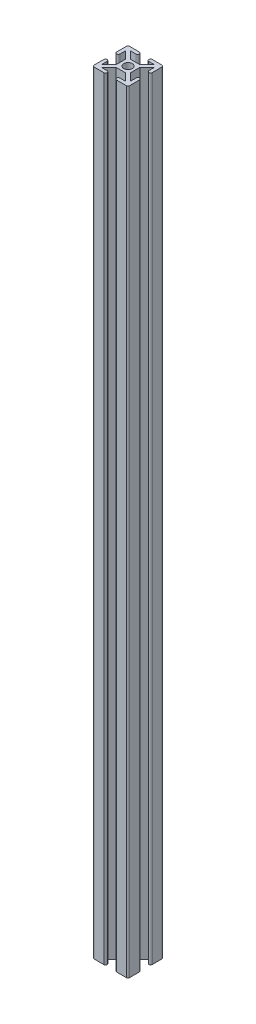
from build123d import *

# Parameters (mm, degrees)
CROQUIS1_R              = 3.645
SALIENTE_EXTRUIR1_DEPTH = 650
CROQUIS2_R              = 4
CORTAR_EXTRUIR1_DEPTH   = 10
CROQUIS3_R              = 4
CORTAR_EXTRUIR2_DEPTH   = 50
SKETCH1_R               = 4
CUT_EXTRUDE1_DEPTH      = 12


with BuildPart() as part:
    # Croquis1 → Saliente-Extruir1 (new body)
    with BuildSketch(Plane(origin=(0, 0, 0), x_dir=(1, 0, 0), z_dir=(0, 1, 0))):
        with BuildLine():
            Line((56.901533346, -4.417095231), (61.626533346, -4.417095231))
            Line((61.626533346, -4.417095231), (55.476533346, 1.732904769))
            Line((55.476533346, 1.732904769), (47.476533346, 1.732904769))
            Line((47.476533346, 1.732904769), (41.326533346, -4.417095231))
            Line((41.326533346, -4.417095231), (46.051533346, -4.417095231))
            ThreePointArc((46.051533346, -4.417095231), (47.476533346, -5.842095231), (46.051533346, -7.267095231))
            Line((46.051533346, -7.267095231), (37.875097573, -7.240659459))
            ThreePointArc((37.875097573, -7.240659459), (36.886163324, -6.83102948), (36.476533346, -5.842095231))
            Line((36.476533346, -5.842095231), (36.476533346, 2.307904769))
            ThreePointArc((36.476533346, 2.307904769), (37.875097573, 3.706468996), (39.2736618, 2.307904769))
            Line((39.2736618, 2.307904769), (39.2736618, -2.417095231))
            Line((39.2736618, -2.417095231), (45.4236618, 3.732904769))
            Line((45.4236618, 3.732904769), (45.4236618, 11.732904769))
            Line((45.4236618, 11.732904769), (39.2736618, 17.882904769))
            Line((39.2736618, 17.882904769), (39.2736618, 13.157904769))
            ThreePointArc((39.2736618, 13.157904769), (37.8486618, 11.732904769), (36.4236618, 13.157904769))
            Line((36.4236618, 13.157904769), (36.4236618, 21.307858179))
            ThreePointArc((36.4236618, 21.307858179), (36.841034637, 22.315485342), (37.8486618, 22.732858179))
            Line((37.8486618, 22.732858179), (45.9986618, 22.732858179))
            ThreePointArc((45.9986618, 22.732858179), (47.4236618, 21.307858179), (45.9986618, 19.882858179))
            Line((45.9986618, 19.882858179), (41.2736618, 19.882858179))
            Line((41.2736618, 19.882858179), (47.4236618, 13.732858179))
            Line((47.4236618, 13.732858179), (55.4236618, 13.732858179))
            Line((55.4236618, 13.732858179), (61.5736618, 19.882858179))
            Line((61.5736618, 19.882858179), (56.8486618, 19.882858179))
            ThreePointArc((56.8486618, 19.882858179), (55.4236618, 21.307858179), (56.8486618, 22.732858179))
            Line((56.8486618, 22.732858179), (64.9986618, 22.732858179))
            ThreePointArc((64.9986618, 22.732858179), (66.006288964, 22.315485342), (66.4236618, 21.307858179))
            Line((66.4236618, 21.307858179), (66.4236618, 13.261601864))
            ThreePointArc((66.4236618, 13.261601864), (64.9986618, 11.836601864), (63.5736618, 13.261601864))
            Line((63.5736618, 13.261601864), (63.5736618, 17.882858179))
            Line((63.5736618, 17.882858179), (57.4236618, 11.732858179))
            Line((57.4236618, 11.732858179), (57.4236618, 3.732858179))
            Line((57.4236618, 3.732858179), (63.5736618, -2.417141821))
            Line((63.5736618, -2.417141821), (63.5736618, 2.411601864))
            ThreePointArc((63.5736618, 2.411601864), (64.9986618, 3.836601864), (66.4236618, 2.411601864))
            Line((66.4236618, 2.411601864), (66.4236618, -5.842095231))
            ThreePointArc((66.4236618, -5.842095231), (66.006288964, -6.849722394), (64.9986618, -7.267095231))
            Line((64.9986618, -7.267095231), (56.901533346, -7.267095231))
            ThreePointArc((56.901533346, -7.267095231), (55.476533346, -5.842095231), (56.901533346, -4.417095231))
        make_face()
        with Locations(Location((51.476533346, 7.732904769, 0), (0, 0, 270))):
            Circle(CROQUIS1_R, mode=Mode.SUBTRACT)
    extrude(amount=SALIENTE_EXTRUIR1_DEPTH)

    # Croquis2 → Cortar-Extruir1 (cut)
    with BuildSketch(Plane.XY.offset(-1.732904769)):
        with Locations((51.476533346, 18.84)):
            Circle(CROQUIS2_R)
    extrude(amount=-CORTAR_EXTRUIR1_DEPTH, mode=Mode.SUBTRACT)

    # Croquis3 → Cortar-Extruir2 (cut)
    with BuildSketch(Plane.XY.offset(-1.732904769)):
        with Locations((51.476533346, 18.84)):
            Circle(CROQUIS3_R)
        with Locations((51.476533346, 75.14)):
            Circle(CROQUIS3_R)
        with Locations((51.476533346, 198.84)):
            Circle(CROQUIS3_R)
        with Locations((51.476533346, 255.14)):
            Circle(CROQUIS3_R)
    extrude(amount=-CORTAR_EXTRUIR2_DEPTH, mode=Mode.SUBTRACT)

    # Sketch1 → Cut-Extrude1 (cut)
    with BuildSketch(Plane.ZY.offset(-45.4236618)):
        with Locations(Location((-7.785776314, 635.00004659, 0), (0, 0, 189.330176496))):
            Circle(SKETCH1_R)
    extrude(amount=-CUT_EXTRUDE1_DEPTH, mode=Mode.SUBTRACT)


solid = part.part
